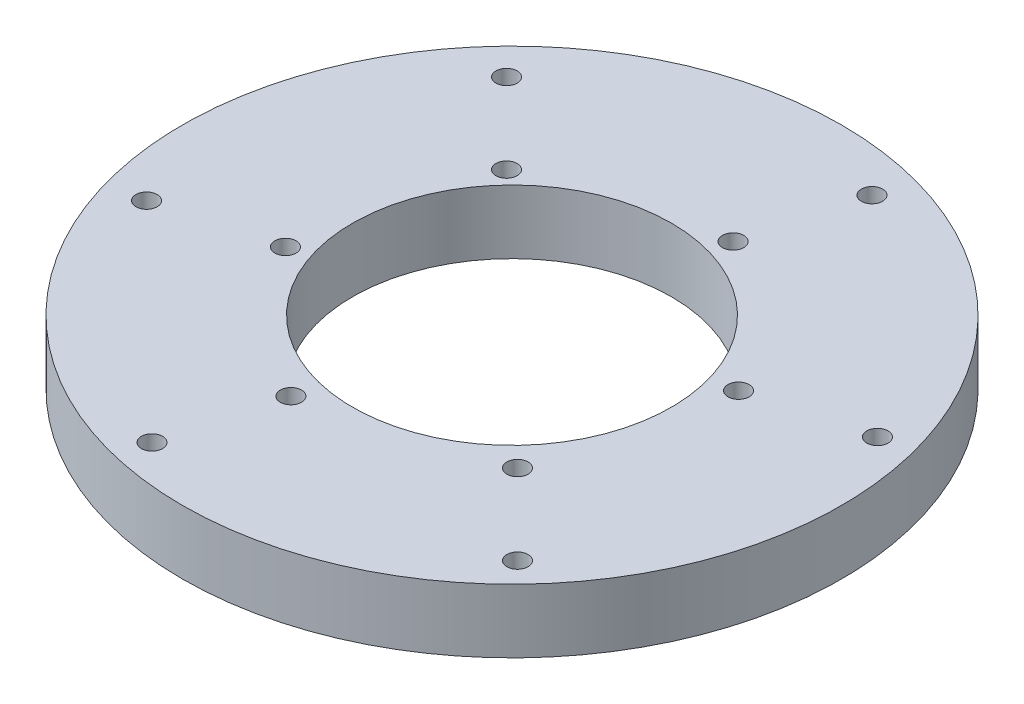
from build123d import *

# Parameters (mm, degrees)
SKETCH1_R           = 98.425
SKETCH1_R_2         = 47.625
BOSS_EXTRUDE1_DEPTH = 19.05
SKETCH2_R           = 3.175
CUT_EXTRUDE1_DEPTH  = 19.05


with BuildPart() as part:
    # Sketch1 → Boss-Extrude1 (new body)
    with BuildSketch(Plane(origin=(0, 0, 0), x_dir=(1, 0, 0), z_dir=(0, 1, 0))):
        with Locations(Location((0, 0, 0), (0, 0, 90))):
            Circle(SKETCH1_R)
        with Locations(Location((0, 0, 0), (0, 0, 90))):
            Circle(SKETCH1_R_2, mode=Mode.SUBTRACT)
    extrude(amount=BOSS_EXTRUDE1_DEPTH)

    # Sketch2 → Cut-Extrude1 (cut)
    with BuildSketch(Plane(origin=(0, 19.05, 0), x_dir=(1, 0, 0), z_dir=(0, 1, 0))):
        with Locations(Location((53.362572273, 14.298458147, 0), (0, 0, 270))):
            Circle(SKETCH2_R)
        with Locations(Location((86.081449469, 23.065454869, 0), (0, 0, 270))):
            Circle(SKETCH2_R)
        with Locations(Location((40.352894367, -38.718786502, 0), (0, 0, 270))):
            Circle(SKETCH2_R)
        with Locations(Location((64.304774841, -62.670666976, 0), (0, 0, 270))):
            Circle(SKETCH2_R)
        with Locations(Location((-12.066225291, -53.960697264, 0), (0, 0, 270))):
            Circle(SKETCH2_R)
        with Locations(Location((-20.833222013, -86.67957446, 0), (0, 0, 270))):
            Circle(SKETCH2_R)
        with Locations(Location((-51.475667042, -16.185363378, 0), (0, 0, 270))):
            Circle(SKETCH2_R)
        with Locations(Location((-84.194544238, -24.9523601, 0), (0, 0, 270))):
            Circle(SKETCH2_R)
        with Locations(Location((-38.465989136, 36.831881271, 0), (0, 0, 270))):
            Circle(SKETCH2_R)
        with Locations(Location((-62.41786961, 60.783761745, 0), (0, 0, 270))):
            Circle(SKETCH2_R)
        with Locations(Location((13.953130522, 52.073792033, 0), (0, 0, 270))):
            Circle(SKETCH2_R)
        with Locations(Location((22.720127244, 84.792669229, 0), (0, 0, 270))):
            Circle(SKETCH2_R)
    extrude(amount=-CUT_EXTRUDE1_DEPTH, mode=Mode.SUBTRACT)


solid = part.part
